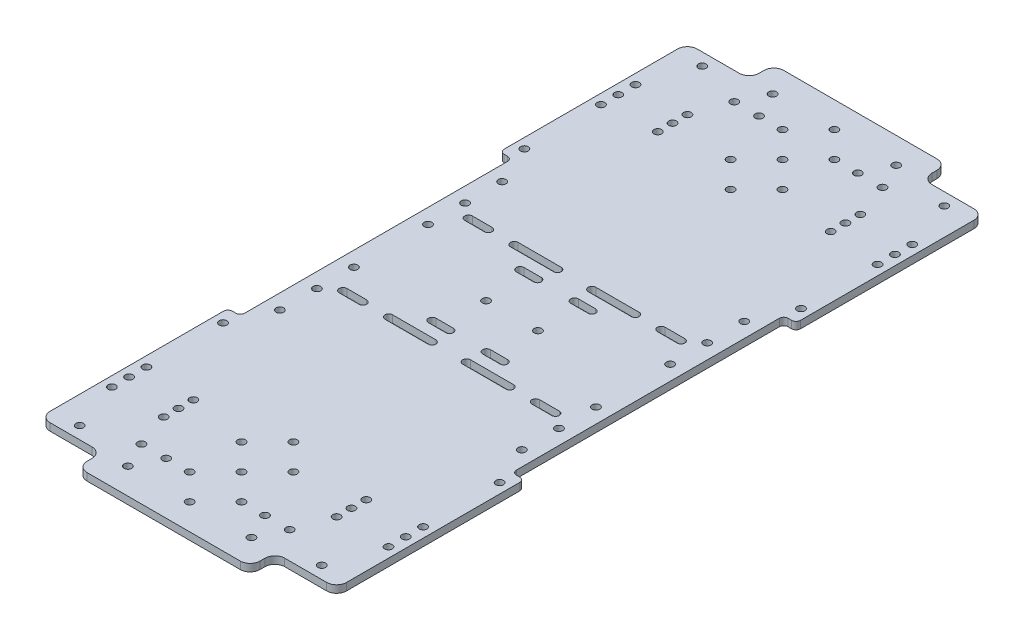
from build123d import *

# Parameters (mm, degrees)
SKETCH_1_R      = 1.55
EXTRUDE_1_DEPTH = 3


with BuildPart() as part:
    # 草图1 → 凸台-拉伸1 (new body)
    with BuildSketch(Plane(origin=(0, 0, 0), x_dir=(1, 0, 0), z_dir=(0, 1, 0))):
        with BuildLine():
            Line((-31, -141), (31, -141))
            ThreePointArc((31, -141), (33.828427125, -139.828427125), (35, -137))
            Line((35, -137), (35, -135))
            ThreePointArc((35, -135), (36.171572875, -132.171572875), (39, -131))
            Line((39, -131), (56, -131))
            ThreePointArc((56, -131), (58.828427125, -129.828427125), (60, -127))
            Line((60, -127), (60, -56.8))
            ThreePointArc((60, -56.8), (59.472792206, -55.527207794), (58.2, -55))
            Line((58.2, -55), (56.8, -55))
            ThreePointArc((56.8, -55), (55.527207794, -54.472792206), (55, -53.2))
            Line((55, -53.2), (55, 53.2))
            ThreePointArc((55, 53.2), (55.527207794, 54.472792206), (56.8, 55))
            Line((56.8, 55), (58.2, 55))
            ThreePointArc((58.2, 55), (59.472792206, 55.527207794), (60, 56.8))
            Line((60, 56.8), (60, 127))
            ThreePointArc((60, 127), (58.828427125, 129.828427125), (56, 131))
            Line((56, 131), (39, 131))
            ThreePointArc((39, 131), (36.171572875, 132.171572875), (35, 135))
            Line((35, 135), (35, 137))
            ThreePointArc((35, 137), (33.828427125, 139.828427125), (31, 141))
            Line((31, 141), (-31, 141))
            ThreePointArc((-31, 141), (-33.828427125, 139.828427125), (-35, 137))
            Line((-35, 137), (-35, 135))
            ThreePointArc((-35, 135), (-36.171572875, 132.171572875), (-39, 131))
            Line((-39, 131), (-56, 131))
            ThreePointArc((-56, 131), (-58.828427125, 129.828427125), (-60, 127))
            Line((-60, 127), (-60, 56.8))
            ThreePointArc((-60, 56.8), (-59.472792206, 55.527207794), (-58.2, 55))
            Line((-58.2, 55), (-56.8, 55))
            ThreePointArc((-56.8, 55), (-55.527207794, 54.472792206), (-55, 53.2))
            Line((-55, 53.2), (-55, -53.2))
            ThreePointArc((-55, -53.2), (-55.527207794, -54.472792206), (-56.8, -55))
            Line((-56.8, -55), (-58.2, -55))
            ThreePointArc((-58.2, -55), (-59.472792206, -55.527207794), (-60, -56.8))
            Line((-60, -56.8), (-60, -127))
            ThreePointArc((-60, -127), (-58.828427125, -129.828427125), (-56, -131))
            Line((-56, -131), (-39, -131))
            ThreePointArc((-39, -131), (-36.171572875, -132.171572875), (-35, -135))
            Line((-35, -135), (-35, -137))
            ThreePointArc((-35, -137), (-33.828427125, -139.828427125), (-31, -141))
        make_face()
        with Locations(Location((0, -130.5, 0), (0, 0, 270))):
            Circle(SKETCH_1_R, mode=Mode.SUBTRACT)
        with Locations(Location((0, -109.5, 0), (0, 0, 270))):
            Circle(SKETCH_1_R, mode=Mode.SUBTRACT)
        with Locations(Location((0, -88.5, 0), (0, 0, 270))):
            Circle(SKETCH_1_R, mode=Mode.SUBTRACT)
        with Locations(Location((10.5, -120, 0), (0, 0, 270))):
            Circle(SKETCH_1_R, mode=Mode.SUBTRACT)
        with Locations(Location((10.5, -99, 0), (0, 0, 270))):
            Circle(SKETCH_1_R, mode=Mode.SUBTRACT)
        with Locations(Location((20, -120, 0), (0, 0, 270))):
            Circle(SKETCH_1_R, mode=Mode.SUBTRACT)
        with Locations(Location((30, -120, 0), (0, 0, 270))):
            Circle(SKETCH_1_R, mode=Mode.SUBTRACT)
        with Locations(Location((25, -130.5, 0), (0, 0, 270))):
            Circle(SKETCH_1_R, mode=Mode.SUBTRACT)
        with Locations(Location((49, -126, 0), (0, 0, 270))):
            Circle(SKETCH_1_R, mode=Mode.SUBTRACT)
        with Locations(Location((56, -106, 0), (0, 0, 270))):
            Circle(SKETCH_1_R, mode=Mode.SUBTRACT)
        with Locations(Location((56, -99, 0), (0, 0, 270))):
            Circle(SKETCH_1_R, mode=Mode.SUBTRACT)
        with Locations(Location((56, -92, 0), (0, 0, 270))):
            Circle(SKETCH_1_R, mode=Mode.SUBTRACT)
        with Locations(Location((56, -61, 0), (0, 0, 270))):
            Circle(SKETCH_1_R, mode=Mode.SUBTRACT)
        with Locations(Location((35, -106, 0), (0, 0, 270))):
            Circle(SKETCH_1_R, mode=Mode.SUBTRACT)
        with Locations(Location((35, -100, 0), (0, 0, 270))):
            Circle(SKETCH_1_R, mode=Mode.SUBTRACT)
        with Locations(Location((35, -94, 0), (0, 0, 270))):
            Circle(SKETCH_1_R, mode=Mode.SUBTRACT)
        with Locations(Location((49, -45, 0), (0, 0, 270))):
            Circle(SKETCH_1_R, mode=Mode.SUBTRACT)
        with Locations(Location((49, -30, 0), (0, 0, 270))):
            Circle(SKETCH_1_R, mode=Mode.SUBTRACT)
        with Locations(Location((49, -15, 0), (0, 0, 270))):
            Circle(SKETCH_1_R, mode=Mode.SUBTRACT)
        with Locations(Location((10.5, 0, 0), (0, 0, 270))):
            Circle(SKETCH_1_R, mode=Mode.SUBTRACT)
        with Locations(Location((-10.5, 0, 0), (0, 0, 90))):
            Circle(SKETCH_1_R, mode=Mode.SUBTRACT)
        with Locations(Location((-49, -15, 0), (0, 0, 90))):
            Circle(SKETCH_1_R, mode=Mode.SUBTRACT)
        with Locations(Location((-49, -30, 0), (0, 0, 90))):
            Circle(SKETCH_1_R, mode=Mode.SUBTRACT)
        with Locations(Location((-49, -45, 0), (0, 0, 90))):
            Circle(SKETCH_1_R, mode=Mode.SUBTRACT)
        with Locations(Location((-35, -94, 0), (0, 0, 90))):
            Circle(SKETCH_1_R, mode=Mode.SUBTRACT)
        with Locations(Location((-35, -100, 0), (0, 0, 90))):
            Circle(SKETCH_1_R, mode=Mode.SUBTRACT)
        with Locations(Location((-35, -106, 0), (0, 0, 90))):
            Circle(SKETCH_1_R, mode=Mode.SUBTRACT)
        with Locations(Location((-56, -61, 0), (0, 0, 90))):
            Circle(SKETCH_1_R, mode=Mode.SUBTRACT)
        with Locations(Location((-56, -92, 0), (0, 0, 90))):
            Circle(SKETCH_1_R, mode=Mode.SUBTRACT)
        with Locations(Location((-56, -99, 0), (0, 0, 90))):
            Circle(SKETCH_1_R, mode=Mode.SUBTRACT)
        with Locations(Location((-56, -106, 0), (0, 0, 90))):
            Circle(SKETCH_1_R, mode=Mode.SUBTRACT)
        with Locations(Location((-49, -126, 0), (0, 0, 90))):
            Circle(SKETCH_1_R, mode=Mode.SUBTRACT)
        with Locations(Location((-25, -130.5, 0), (0, 0, 90))):
            Circle(SKETCH_1_R, mode=Mode.SUBTRACT)
        with Locations(Location((-30, -120, 0), (0, 0, 90))):
            Circle(SKETCH_1_R, mode=Mode.SUBTRACT)
        with Locations(Location((-20, -120, 0), (0, 0, 90))):
            Circle(SKETCH_1_R, mode=Mode.SUBTRACT)
        with Locations(Location((-10.5, -99, 0), (0, 0, 90))):
            Circle(SKETCH_1_R, mode=Mode.SUBTRACT)
        with Locations(Location((-10.5, -120, 0), (0, 0, 90))):
            Circle(SKETCH_1_R, mode=Mode.SUBTRACT)
        with Locations(Location((-10.5, 120, 0), (0, 0, 270))):
            Circle(SKETCH_1_R, mode=Mode.SUBTRACT)
        with Locations(Location((-10.5, 99, 0), (0, 0, 270))):
            Circle(SKETCH_1_R, mode=Mode.SUBTRACT)
        with Locations(Location((-20, 120, 0), (0, 0, 270))):
            Circle(SKETCH_1_R, mode=Mode.SUBTRACT)
        with Locations(Location((-30, 120, 0), (0, 0, 270))):
            Circle(SKETCH_1_R, mode=Mode.SUBTRACT)
        with Locations(Location((-25, 130.5, 0), (0, 0, 270))):
            Circle(SKETCH_1_R, mode=Mode.SUBTRACT)
        with Locations(Location((-49, 126, 0), (0, 0, 270))):
            Circle(SKETCH_1_R, mode=Mode.SUBTRACT)
        with Locations(Location((-56, 106, 0), (0, 0, 270))):
            Circle(SKETCH_1_R, mode=Mode.SUBTRACT)
        with Locations(Location((-56, 99, 0), (0, 0, 270))):
            Circle(SKETCH_1_R, mode=Mode.SUBTRACT)
        with Locations(Location((-56, 92, 0), (0, 0, 270))):
            Circle(SKETCH_1_R, mode=Mode.SUBTRACT)
        with Locations(Location((-56, 61, 0), (0, 0, 270))):
            Circle(SKETCH_1_R, mode=Mode.SUBTRACT)
        with Locations(Location((-35, 106, 0), (0, 0, 270))):
            Circle(SKETCH_1_R, mode=Mode.SUBTRACT)
        with Locations(Location((-35, 100, 0), (0, 0, 270))):
            Circle(SKETCH_1_R, mode=Mode.SUBTRACT)
        with Locations(Location((-35, 94, 0), (0, 0, 270))):
            Circle(SKETCH_1_R, mode=Mode.SUBTRACT)
        with Locations(Location((-49, 45, 0), (0, 0, 270))):
            Circle(SKETCH_1_R, mode=Mode.SUBTRACT)
        with Locations(Location((-49, 30, 0), (0, 0, 270))):
            Circle(SKETCH_1_R, mode=Mode.SUBTRACT)
        with Locations(Location((-49, 15, 0), (0, 0, 270))):
            Circle(SKETCH_1_R, mode=Mode.SUBTRACT)
        with Locations(Location((49, 15, 0), (0, 0, 90))):
            Circle(SKETCH_1_R, mode=Mode.SUBTRACT)
        with Locations(Location((49, 30, 0), (0, 0, 90))):
            Circle(SKETCH_1_R, mode=Mode.SUBTRACT)
        with Locations(Location((49, 45, 0), (0, 0, 90))):
            Circle(SKETCH_1_R, mode=Mode.SUBTRACT)
        with Locations(Location((35, 94, 0), (0, 0, 90))):
            Circle(SKETCH_1_R, mode=Mode.SUBTRACT)
        with Locations(Location((35, 100, 0), (0, 0, 90))):
            Circle(SKETCH_1_R, mode=Mode.SUBTRACT)
        with Locations(Location((35, 106, 0), (0, 0, 90))):
            Circle(SKETCH_1_R, mode=Mode.SUBTRACT)
        with Locations(Location((56, 61, 0), (0, 0, 90))):
            Circle(SKETCH_1_R, mode=Mode.SUBTRACT)
        with Locations(Location((56, 92, 0), (0, 0, 90))):
            Circle(SKETCH_1_R, mode=Mode.SUBTRACT)
        with Locations(Location((56, 99, 0), (0, 0, 90))):
            Circle(SKETCH_1_R, mode=Mode.SUBTRACT)
        with Locations(Location((56, 106, 0), (0, 0, 90))):
            Circle(SKETCH_1_R, mode=Mode.SUBTRACT)
        with Locations(Location((49, 126, 0), (0, 0, 90))):
            Circle(SKETCH_1_R, mode=Mode.SUBTRACT)
        with Locations(Location((25, 130.5, 0), (0, 0, 90))):
            Circle(SKETCH_1_R, mode=Mode.SUBTRACT)
        with Locations(Location((30, 120, 0), (0, 0, 90))):
            Circle(SKETCH_1_R, mode=Mode.SUBTRACT)
        with Locations(Location((20, 120, 0), (0, 0, 90))):
            Circle(SKETCH_1_R, mode=Mode.SUBTRACT)
        with Locations(Location((10.5, 99, 0), (0, 0, 90))):
            Circle(SKETCH_1_R, mode=Mode.SUBTRACT)
        with Locations(Location((10.5, 120, 0), (0, 0, 90))):
            Circle(SKETCH_1_R, mode=Mode.SUBTRACT)
        with Locations(Location((0, 88.5, 0), (0, 0, 90))):
            Circle(SKETCH_1_R, mode=Mode.SUBTRACT)
        with Locations(Location((0, 109.5, 0), (0, 0, 90))):
            Circle(SKETCH_1_R, mode=Mode.SUBTRACT)
        with Locations(Location((0, 130.5, 0), (0, 0, 90))):
            Circle(SKETCH_1_R, mode=Mode.SUBTRACT)
        with BuildLine():
            Line((7.5, -16.25), (14.5, -16.25))
            ThreePointArc((14.5, -16.25), (16.05, -17.8), (14.5, -19.35))
            Line((14.5, -19.35), (7.5, -19.35))
            ThreePointArc((7.5, -19.35), (5.95, -17.8), (7.5, -16.25))
        make_face(mode=Mode.SUBTRACT)
        with BuildLine():
            Line((7, -23.85), (24.5, -23.85))
            ThreePointArc((24.5, -23.85), (26.05, -25.4), (24.5, -26.95))
            Line((24.5, -26.95), (7, -26.95))
            ThreePointArc((7, -26.95), (5.45, -25.4), (7, -23.85))
        make_face(mode=Mode.SUBTRACT)
        with BuildLine():
            Line((35, -23.85), (43, -23.85))
            ThreePointArc((43, -23.85), (44.55, -25.4), (43, -26.95))
            Line((43, -26.95), (35, -26.95))
            ThreePointArc((35, -26.95), (33.45, -25.4), (35, -23.85))
        make_face(mode=Mode.SUBTRACT)
        with BuildLine():
            Line((-35, -23.85), (-43, -23.85))
            ThreePointArc((-43, -23.85), (-44.55, -25.4), (-43, -26.95))
            Line((-43, -26.95), (-35, -26.95))
            ThreePointArc((-35, -26.95), (-33.45, -25.4), (-35, -23.85))
        make_face(mode=Mode.SUBTRACT)
        with BuildLine():
            Line((-7, -23.85), (-24.5, -23.85))
            ThreePointArc((-24.5, -23.85), (-26.05, -25.4), (-24.5, -26.95))
            Line((-24.5, -26.95), (-7, -26.95))
            ThreePointArc((-7, -26.95), (-5.45, -25.4), (-7, -23.85))
        make_face(mode=Mode.SUBTRACT)
        with BuildLine():
            Line((-7.5, -16.25), (-14.5, -16.25))
            ThreePointArc((-14.5, -16.25), (-16.05, -17.8), (-14.5, -19.35))
            Line((-14.5, -19.35), (-7.5, -19.35))
            ThreePointArc((-7.5, -19.35), (-5.95, -17.8), (-7.5, -16.25))
        make_face(mode=Mode.SUBTRACT)
        with BuildLine():
            Line((-7.5, 16.25), (-14.5, 16.25))
            ThreePointArc((-14.5, 16.25), (-16.05, 17.8), (-14.5, 19.35))
            Line((-14.5, 19.35), (-7.5, 19.35))
            ThreePointArc((-7.5, 19.35), (-5.95, 17.8), (-7.5, 16.25))
        make_face(mode=Mode.SUBTRACT)
        with BuildLine():
            Line((-7, 23.85), (-24.5, 23.85))
            ThreePointArc((-24.5, 23.85), (-26.05, 25.4), (-24.5, 26.95))
            Line((-24.5, 26.95), (-7, 26.95))
            ThreePointArc((-7, 26.95), (-5.45, 25.4), (-7, 23.85))
        make_face(mode=Mode.SUBTRACT)
        with BuildLine():
            Line((-35, 23.85), (-43, 23.85))
            ThreePointArc((-43, 23.85), (-44.55, 25.4), (-43, 26.95))
            Line((-43, 26.95), (-35, 26.95))
            ThreePointArc((-35, 26.95), (-33.45, 25.4), (-35, 23.85))
        make_face(mode=Mode.SUBTRACT)
        with BuildLine():
            Line((35, 23.85), (43, 23.85))
            ThreePointArc((43, 23.85), (44.55, 25.4), (43, 26.95))
            Line((43, 26.95), (35, 26.95))
            ThreePointArc((35, 26.95), (33.45, 25.4), (35, 23.85))
        make_face(mode=Mode.SUBTRACT)
        with BuildLine():
            Line((7, 23.85), (24.5, 23.85))
            ThreePointArc((24.5, 23.85), (26.05, 25.4), (24.5, 26.95))
            Line((24.5, 26.95), (7, 26.95))
            ThreePointArc((7, 26.95), (5.45, 25.4), (7, 23.85))
        make_face(mode=Mode.SUBTRACT)
        with BuildLine():
            Line((7.5, 16.25), (14.5, 16.25))
            ThreePointArc((14.5, 16.25), (16.05, 17.8), (14.5, 19.35))
            Line((14.5, 19.35), (7.5, 19.35))
            ThreePointArc((7.5, 19.35), (5.95, 17.8), (7.5, 16.25))
        make_face(mode=Mode.SUBTRACT)
    extrude(amount=EXTRUDE_1_DEPTH)


solid = part.part
